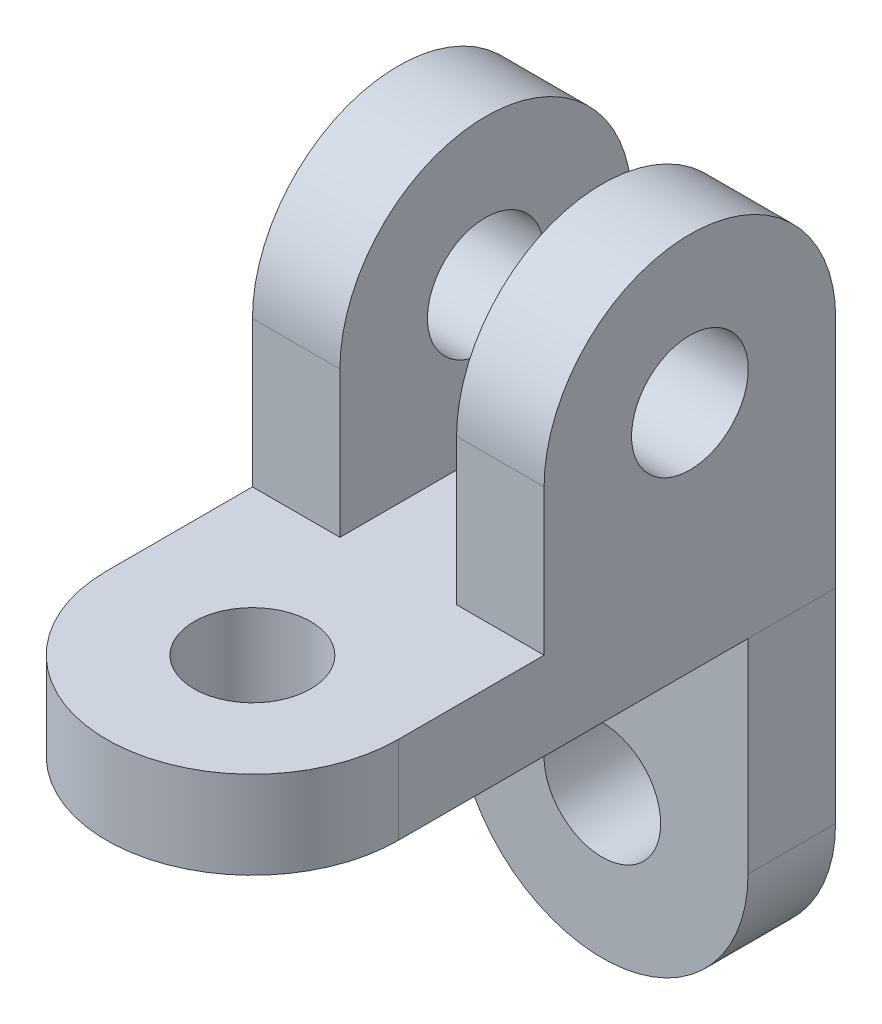
from build123d import *

# Parameters (mm, degrees)
SKETCH1_R           = 8
BOSS_EXTRUDE1_DEPTH = 12
BOSS_EXTRUDE2_START = 8
SKETCH2_R           = 8
BOSS_EXTRUDE2_DEPTH = 12
BOSS_EXTRUDE3_START = -20
SKETCH2_3_R         = 8
BOSS_EXTRUDE3_DEPTH = 12
SKETCH3_R           = 8
BOSS_EXTRUDE4_DEPTH = 12


with BuildPart() as part:
    # Sketch1 → Boss-Extrude1 (new body)
    with BuildSketch(Plane(origin=(0, 0, 0), x_dir=(1, 0, 0), z_dir=(0, 1, 0))):
        with BuildLine():
            Line((20, -60), (20, 0))
            Line((20, 0), (-20, 0))
            Line((-20, 0), (-20, -60))
            ThreePointArc((-20, -60), (0, -80), (20, -60))
        make_face()
        with Locations((0, -60)):
            Circle(SKETCH1_R, mode=Mode.SUBTRACT)
    extrude(amount=BOSS_EXTRUDE1_DEPTH)

    # Sketch2 → Boss-Extrude2 (add)
    with BuildSketch(Plane(origin=(0, 0, 0), x_dir=(0, 0, -1), z_dir=(1, 0, 0)).offset(BOSS_EXTRUDE2_START)):
        with BuildLine():
            Line((-40, 12), (0, 12))
            Line((0, 12), (0, 32))
            ThreePointArc((0, 32), (-20, 52), (-40, 32))
            Line((-40, 32), (-40, 12))
        make_face()
        with Locations((-20, 32)):
            Circle(SKETCH2_R, mode=Mode.SUBTRACT)
    extrude(amount=BOSS_EXTRUDE2_DEPTH)

    # Sketch2<3> → Boss-Extrude3 (add)
    with BuildSketch(Plane(origin=(0, 0, 0), x_dir=(0, 0, -1), z_dir=(1, 0, 0)).offset(BOSS_EXTRUDE3_START)):
        with BuildLine():
            Line((-40, 12), (0, 12))
            Line((0, 12), (0, 32))
            ThreePointArc((0, 32), (-20, 52), (-40, 32))
            Line((-40, 32), (-40, 12))
        make_face()
        with Locations((-20, 32)):
            Circle(SKETCH2_3_R, mode=Mode.SUBTRACT)
    extrude(amount=BOSS_EXTRUDE3_DEPTH)

    # Sketch3 → Boss-Extrude4 (add)
    with BuildSketch(Plane.XY):
        with BuildLine():
            Line((20, 0), (-20, 0))
            Line((-20, 0), (-20, -28))
            ThreePointArc((-20, -28), (-0.013931924, -47.986068076), (19.972136151, -28))
            Line((19.972136151, -28), (20, 0))
        make_face()
        with Locations((-0.013931924, -28)):
            Circle(SKETCH3_R, mode=Mode.SUBTRACT)
    extrude(amount=BOSS_EXTRUDE4_DEPTH)


solid = part.part
